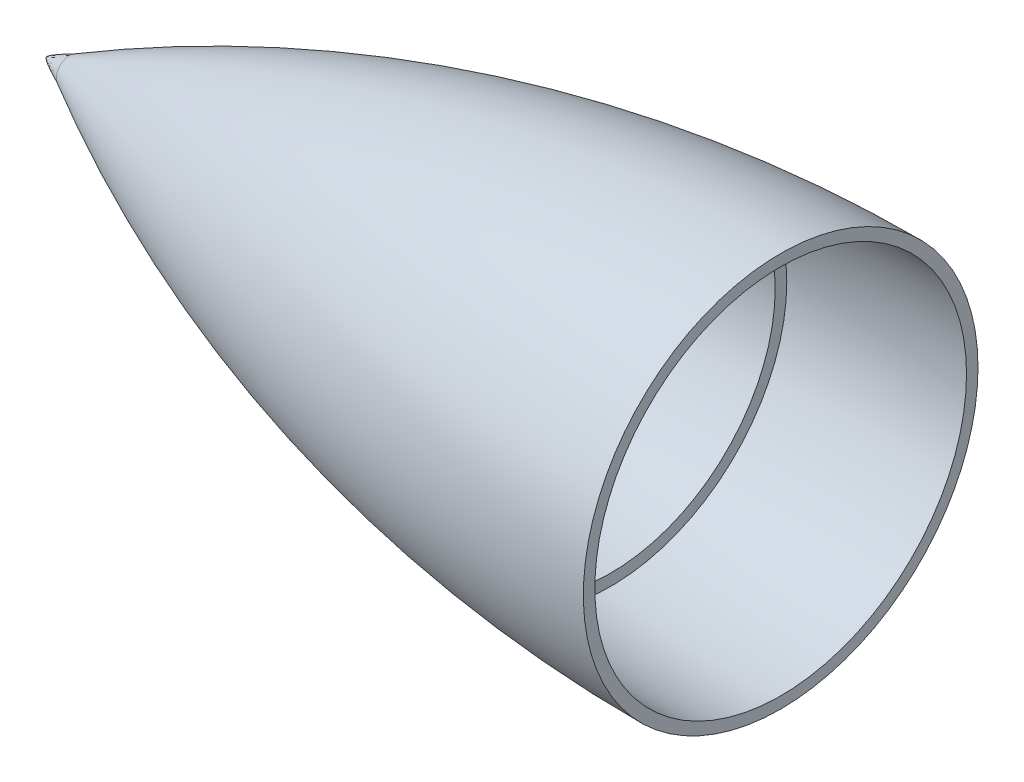
from build123d import *


with BuildPart() as part:
    # Sketch1 → Revolve1 (revolve)
    with BuildSketch(Plane.XY, mode=Mode.PRIVATE) as revolve1_sk:
        with BuildLine():
            Line((0, 319.174418605), (0, 316.674418605))
            ThreePointArc((0, 316.674418605), (-18.53175896, 316.131715126), (-37, 314.505464815))
            Line((-37, 314.505464815), (-37, 311.988085198))
            ThreePointArc((-37, 311.988085198), (-95.089955746, 299.438584056), (-149.777354143, 276.174418605))
            Line((-149.777354143, 276.174418605), (-160, 276.174418605))
            ThreePointArc((-160, 276.174418605), (-82.838698686, 308.237018367), (0, 319.174418605))
        make_face()
    revolve(revolve1_sk.sketch.rotate(Axis((81, 276.174418605, 0), (-1, 0, 0)), 90), axis=Axis((81, 276.174418605, 0), (-1, 0, 0)))

    # Sketch2 → Cut-Revolve1 (revolve, cut)
    with BuildSketch(Plane.XY, mode=Mode.PRIVATE) as cut_revolve1_sk:
        with BuildLine():
            Line((-155, 276.174418605), (-155, 279.011307104))
            ThreePointArc((-155, 279.011307104), (-157.506387122, 277.60412012), (-160, 276.174418605))
            Line((-160, 276.174418605), (-155, 276.174418605))
        make_face()
    revolve(cut_revolve1_sk.sketch.rotate(Axis((-160, 276.174418605, 0), (1, 0, 0)), 180), axis=Axis((-160, 276.174418605, 0), (1, 0, 0)), mode=Mode.SUBTRACT)

    # Sketch3 → Revolve2 (revolve)
    with BuildSketch(Plane.XY, mode=Mode.PRIVATE) as revolve2_sk:
        with BuildLine():
            Line((-155, 279.011307104), (-155, 276.174418605))
            Line((-155, 276.174418605), (-160, 276.174418605))
            add(Edge.make_bspline(
                [(-155, 279.011307104), (-160.028237864, 276.68923445), (-160, 276.174418605)],
                knots=[0, 0, 0, 0.5, 0.5, 0.5], degree=2))
        make_face()
    revolve(revolve2_sk.sketch.rotate(Axis((-155, 276.174418605, 0), (-1, 0, 0)), 180), axis=Axis((-155, 276.174418605, 0), (-1, 0, 0)))


solid = part.part
